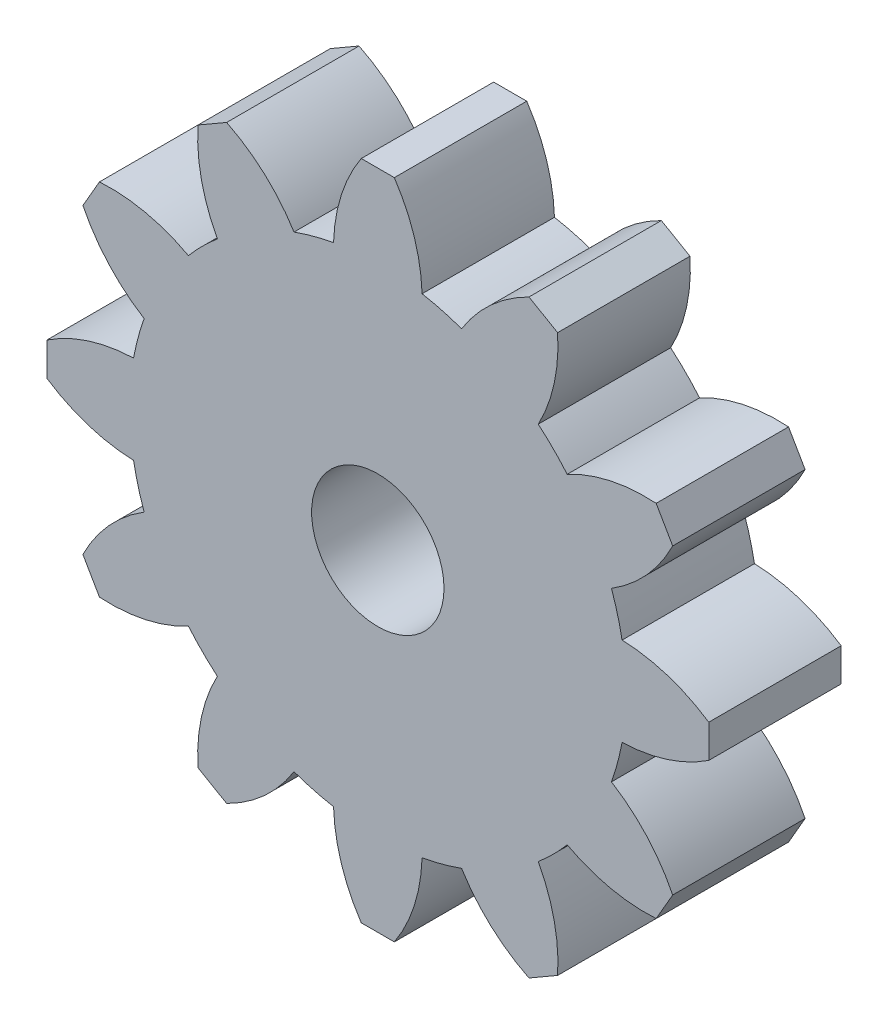
from build123d import *

# Parameters (mm, degrees)
SKETCH1_R           = 4
BOSS_EXTRUDE1_DEPTH = 8


with BuildPart() as part:
    # Sketch1 → Boss-Extrude1 (new body)
    with BuildSketch(Plane.XY):
        with BuildLine():
            Line((-1, 20), (1, 20))
            ThreePointArc((1, 20), (2.204975942, 17.497232023), (2.675, 14.759551992))
            ThreePointArc((2.675, 14.759551992), (3.882285677, 14.488887394), (5.063158041, 14.119646973))
            ThreePointArc((5.063158041, 14.119646973), (6.839050831, 16.255535399), (9.133974596, 17.820508076))
            Line((9.133974596, 17.820508076), (10.866025404, 16.820508076))
            ThreePointArc((10.866025404, 16.820508076), (10.658181192, 14.050559457), (9.696393951, 11.444646973))
            ThreePointArc((9.696393951, 11.444646973), (10.606601718, 10.606601718), (11.444646973, 9.696393951))
            ThreePointArc((11.444646973, 9.696393951), (14.050559457, 10.658181192), (16.820508076, 10.866025404))
            Line((16.820508076, 10.866025404), (17.820508076, 9.133974596))
            ThreePointArc((17.820508076, 9.133974596), (16.255535399, 6.839050831), (14.119646973, 5.063158041))
            ThreePointArc((14.119646973, 5.063158041), (14.488887394, 3.882285677), (14.759551992, 2.675))
            ThreePointArc((14.759551992, 2.675), (17.497232023, 2.204975942), (20, 1))
            Line((20, 1), (20, -1))
            ThreePointArc((20, -1), (17.497232023, -2.204975942), (14.759551992, -2.675))
            ThreePointArc((14.759551992, -2.675), (14.488887394, -3.882285677), (14.119646973, -5.063158041))
            ThreePointArc((14.119646973, -5.063158041), (16.255535399, -6.839050831), (17.820508076, -9.133974596))
            Line((17.820508076, -9.133974596), (16.820508076, -10.866025404))
            ThreePointArc((16.820508076, -10.866025404), (14.050559457, -10.658181192), (11.444646973, -9.696393951))
            ThreePointArc((11.444646973, -9.696393951), (10.606601718, -10.606601718), (9.696393951, -11.444646973))
            ThreePointArc((9.696393951, -11.444646973), (10.658181192, -14.050559457), (10.866025404, -16.820508076))
            Line((10.866025404, -16.820508076), (9.133974596, -17.820508076))
            ThreePointArc((9.133974596, -17.820508076), (6.839050831, -16.255535399), (5.063158041, -14.119646973))
            ThreePointArc((5.063158041, -14.119646973), (3.882285677, -14.488887394), (2.675, -14.759551992))
            ThreePointArc((2.675, -14.759551992), (2.204975942, -17.497232023), (1, -20))
            Line((1, -20), (-1, -20))
            ThreePointArc((-1, -20), (-2.204975942, -17.497232023), (-2.675, -14.759551992))
            ThreePointArc((-2.675, -14.759551992), (-3.882285677, -14.488887394), (-5.063158041, -14.119646973))
            ThreePointArc((-5.063158041, -14.119646973), (-6.839050831, -16.255535399), (-9.133974596, -17.820508076))
            Line((-9.133974596, -17.820508076), (-10.866025404, -16.820508076))
            ThreePointArc((-10.866025404, -16.820508076), (-10.658181192, -14.050559457), (-9.696393951, -11.444646973))
            ThreePointArc((-9.696393951, -11.444646973), (-10.606601718, -10.606601718), (-11.444646973, -9.696393951))
            ThreePointArc((-11.444646973, -9.696393951), (-14.050559457, -10.658181192), (-16.820508076, -10.866025404))
            Line((-16.820508076, -10.866025404), (-17.820508076, -9.133974596))
            ThreePointArc((-17.820508076, -9.133974596), (-16.255535399, -6.839050831), (-14.119646973, -5.063158041))
            ThreePointArc((-14.119646973, -5.063158041), (-14.488887394, -3.882285677), (-14.759551992, -2.675))
            ThreePointArc((-14.759551992, -2.675), (-17.497232023, -2.204975942), (-20, -1))
            Line((-20, -1), (-20, 1))
            ThreePointArc((-20, 1), (-17.497232023, 2.204975942), (-14.759551992, 2.675))
            ThreePointArc((-14.759551992, 2.675), (-14.488887394, 3.882285677), (-14.119646973, 5.063158041))
            ThreePointArc((-14.119646973, 5.063158041), (-16.255535399, 6.839050831), (-17.820508076, 9.133974596))
            Line((-17.820508076, 9.133974596), (-16.820508076, 10.866025404))
            ThreePointArc((-16.820508076, 10.866025404), (-14.050559457, 10.658181192), (-11.444646973, 9.696393951))
            ThreePointArc((-11.444646973, 9.696393951), (-10.606601718, 10.606601718), (-9.696393951, 11.444646973))
            ThreePointArc((-9.696393951, 11.444646973), (-10.658181192, 14.050559457), (-10.866025404, 16.820508076))
            Line((-10.866025404, 16.820508076), (-9.133974596, 17.820508076))
            ThreePointArc((-9.133974596, 17.820508076), (-6.839050831, 16.255535399), (-5.063158041, 14.119646973))
            ThreePointArc((-5.063158041, 14.119646973), (-3.882285677, 14.488887394), (-2.675, 14.759551992))
            ThreePointArc((-2.675, 14.759551992), (-2.204975942, 17.497232023), (-1, 20))
        make_face()
        Circle(SKETCH1_R, mode=Mode.SUBTRACT)
    extrude(amount=BOSS_EXTRUDE1_DEPTH)


solid = part.part
